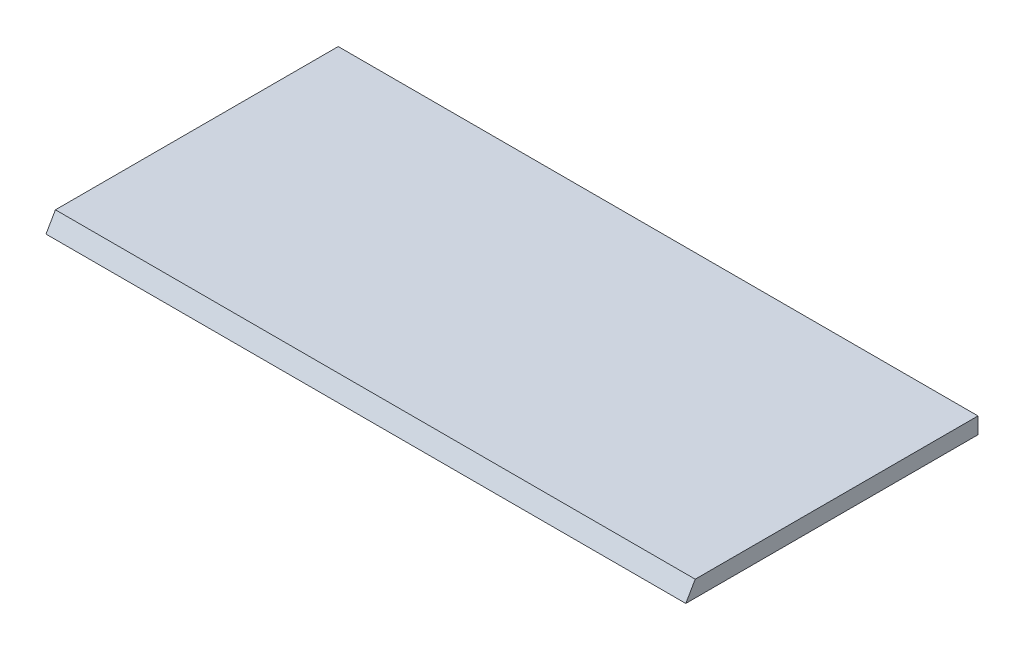
from build123d import *

# Parameters (mm, degrees)
SALIENTE_EXTRUIR1_DEPTH = 196
VACIADO1_T              = -4


with BuildPart() as part:
    # Croquis1 → Saliente-Extruir1 (new body)
    with BuildSketch(Plane(origin=(0, 0, 0), x_dir=(0, 0, -1), z_dir=(1, 0, 0))):
        Polygon((0, 0), (89.52, 0), (89.52, 5), (2.886751346, 5), align=None)
    extrude(amount=SALIENTE_EXTRUIR1_DEPTH)

    # Vaciado1
    vaciado1_openings = [part.faces().sort_by_distance(p)[0] for p in [
        (98, 0, -44.76),
    ]]
    offset(amount=VACIADO1_T, openings=vaciado1_openings, kind=Kind.INTERSECTION)


solid = part.part
